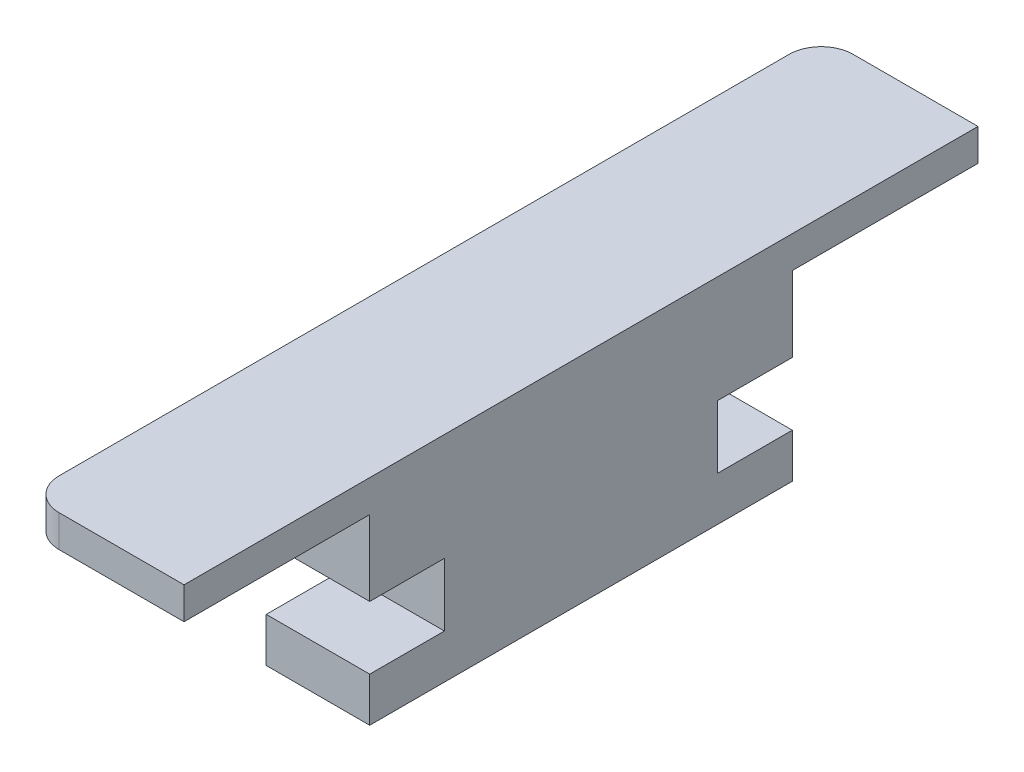
from build123d import *

# Parameters (mm, degrees)
BOSS_EXTRUDE1_DEPTH = 15.3
SKETCH4_W           = 7
SKETCH4_H           = 5.9
CUT_EXTRUDE1_DEPTH  = 78.461901488
SKETCH5_W           = 74.8
SKETCH5_H           = 19.8
BOSS_EXTRUDE2_DEPTH = 2
SKETCH6_W           = 74.8
SKETCH6_H           = 3
BOSS_EXTRUDE3_DEPTH = 37.2
SKETCH7_W           = 37.2
SKETCH7_H           = 3
BOSS_EXTRUDE4_DEPTH = 5
FILLET1_R           = 3
BOSS_EXTRUDE5_DEPTH = 23.3
FILLET2_R           = 2
SKETCH10_W          = 74.8
SKETCH10_H          = 19.8
CUT_EXTRUDE2_DEPTH  = 0.2
CUT_EXTRUDE3_DEPTH  = 5
CUT_EXTRUDE3_DRAFT  = 30
BOSS_EXTRUDE6_DEPTH = 15
CUT_EXTRUDE4_START  = -80.1
SKETCH15_W          = 92.424256673
SKETCH15_H          = 46.662169566
CUT_EXTRUDE4_DEPTH  = 80.1


with BuildPart() as part:
    # Sketch1 → Boss-Extrude1 (new body)
    with BuildSketch(Plane(origin=(0, 0, 0), x_dir=(1, 0, 0), z_dir=(0, 1, 0))):
        with BuildLine():
            Line((1.005677457, 13.08496015), (1.005677457, -6.71503985))
            Line((1.005677457, -6.71503985), (10.705677457, -6.71503985))
            Line((10.705677457, -6.71503985), (10.705677457, 7.68496015))
            ThreePointArc((10.705677457, 7.68496015), (24.690281417, 4.453424809), (33.705677457, -6.71503985))
            Line((33.705677457, -6.71503985), (75.805677457, -6.71503985))
            Line((75.805677457, -6.71503985), (75.805677457, 13.08496015))
            Line((75.805677457, 13.08496015), (1.005677457, 13.08496015))
        make_face()
    extrude(amount=BOSS_EXTRUDE1_DEPTH)

    # Sketch4 → Cut-Extrude1 (cut, through all)
    with BuildSketch(Plane(origin=(75.805677457, 0, 0), x_dir=(0, 0, -1), z_dir=(1, 0, 0))):
        with Locations((-3.21503985, 7.3)):
            Rectangle(SKETCH4_W, SKETCH4_H)
    extrude(amount=-CUT_EXTRUDE1_DEPTH, mode=Mode.SUBTRACT)

    # Sketch5 → Boss-Extrude2 (add)
    with BuildSketch(Plane(origin=(0, 15.3, 0), x_dir=(1, 0, 0), z_dir=(0, 1, 0))):
        with Locations((38.405677457, 3.18496015)):
            Rectangle(SKETCH5_W, SKETCH5_H)
    extrude(amount=BOSS_EXTRUDE2_DEPTH)

    # Sketch6 → Boss-Extrude3 (add)
    with BuildSketch(Plane(origin=(0, 0, -13.08496015), x_dir=(-1, 0, 0), z_dir=(0, 0, -1))):
        with Locations((-38.405677457, 18.8)):
            Rectangle(SKETCH6_W, SKETCH6_H)
    extrude(amount=-BOSS_EXTRUDE3_DEPTH)

    # Sketch7 → Boss-Extrude4 (add)
    with BuildSketch(Plane.ZY.offset(-1.005677457)):
        with Locations((5.51503985, 18.8)):
            Rectangle(SKETCH7_W, SKETCH7_H)
    extrude(amount=BOSS_EXTRUDE4_DEPTH)

    # Fillet1
    fillet1_edges = [part.edges().sort_by_distance(p)[0] for p in [
        (-3.994322543, 18.8, 24.11503985),
    ]]
    fillet(fillet1_edges, radius=FILLET1_R)

    # Sketch8 → Boss-Extrude5 (add)
    with BuildSketch(Plane(origin=(0, 20.3, 0), x_dir=(1, 0, 0), z_dir=(0, 1, 0))):
        with BuildLine():
            Line((75.805677457, 13.08496015), (90.805677457, 13.08496015))
            Line((90.805677457, 13.08496015), (90.805677457, -3.072659154))
            ThreePointArc((90.805677457, -3.072659154), (86.671822493, -15.993396221), (75.805677457, -24.11503985))
            Line((75.805677457, -24.11503985), (75.805677457, 13.08496015))
        make_face()
    extrude(amount=-BOSS_EXTRUDE5_DEPTH)

    # Fillet2
    fillet2_edges = [part.edges().sort_by_distance(p)[0] for p in [
        (90.805677457, -3, -5.006150498),
        (86.671822493, -3, 15.993396221),
    ]]
    fillet(fillet2_edges, radius=FILLET2_R)

    # Sketch10 → Cut-Extrude2 (cut)
    with BuildSketch(Plane(origin=(0, 0, 0), x_dir=(-1, 0, 0), z_dir=(0, -1, 0))):
        with Locations((-38.405677457, 3.18496015)):
            Rectangle(SKETCH10_W, SKETCH10_H)
    extrude(amount=-CUT_EXTRUDE2_DEPTH, mode=Mode.SUBTRACT)


with BuildPart() as cut_extrude3_tool:
    # Sketch11 → Cut-Extrude3 (with draft: the straight prism first)
    with BuildSketch(Plane(origin=(0, -3, 0), x_dir=(-1, 0, 0), z_dir=(0, -1, 0))):
        with BuildLine():
            Line((-75.805677457, 13.08496015), (-83.305677457, 13.08496015))
            Line((-83.305677457, 13.08496015), (-83.305677457, 8.08496015))
            ThreePointArc((-83.305677457, 8.08496015), (-80.312616551, 4.449551508), (-75.805677457, 3.08496015))
            Line((-75.805677457, 3.08496015), (-75.805677457, 13.08496015))
        make_face()
    extrude(amount=-CUT_EXTRUDE3_DEPTH)
    # Cut-Extrude3: the draft: its side faces are tilted about the plane it starts from
    cut_extrude3_sides = [cut_extrude3_tool.faces().sort_by_distance(p)[0] for p in [
        (75.805677457, -0.5, -8.08496015),
        (79.555677457, -0.5, -13.08496015),
        (83.305677457, -0.5, -10.58496015),
        (80.312616551, -0.5, -4.449551508),
    ]]
    draft(cut_extrude3_sides, Plane(origin=(0, -3, 0), x_dir=(-1, 0, 0), z_dir=(0, -1, 0)), CUT_EXTRUDE3_DRAFT)


with BuildPart() as part_1:
    add(part.part)

    # Cut-Extrude3: cut by cut_extrude3_tool
    add(cut_extrude3_tool.part, mode=Mode.SUBTRACT)

    # Sketch14 → Boss-Extrude6 (add)
    with BuildSketch(Plane(origin=(0, 0, -13.08496015), x_dir=(-1, 0, 0), z_dir=(0, 0, -1))):
        Polygon((-72.918926111, 2), (-73.958156595, 0.2), (-75.805677457, 0.2), (-75.805677457, 2), align=None)
    extrude(amount=-BOSS_EXTRUDE6_DEPTH)

    # Mirror1: part across plane


with BuildPart() as part_2:
    add(part_1.part)
    add(part_1.part.mirror(Plane(origin=(0, 15.3, -13.08496015), x_dir=(1, 0, 0), z_dir=(0, 0, -1))))

    # Sketch15 → Cut-Extrude4 (cut)
    with BuildSketch(Plane(origin=(90.805677457, 0, 0), x_dir=(0, 0, -1), z_dir=(1, 0, 0)).offset(CUT_EXTRUDE4_START)):
        with Locations((15.406225438, 7.825251121)):
            Rectangle(SKETCH15_W, SKETCH15_H)
    extrude(amount=CUT_EXTRUDE4_DEPTH, mode=Mode.SUBTRACT)


solid = part_2.part
